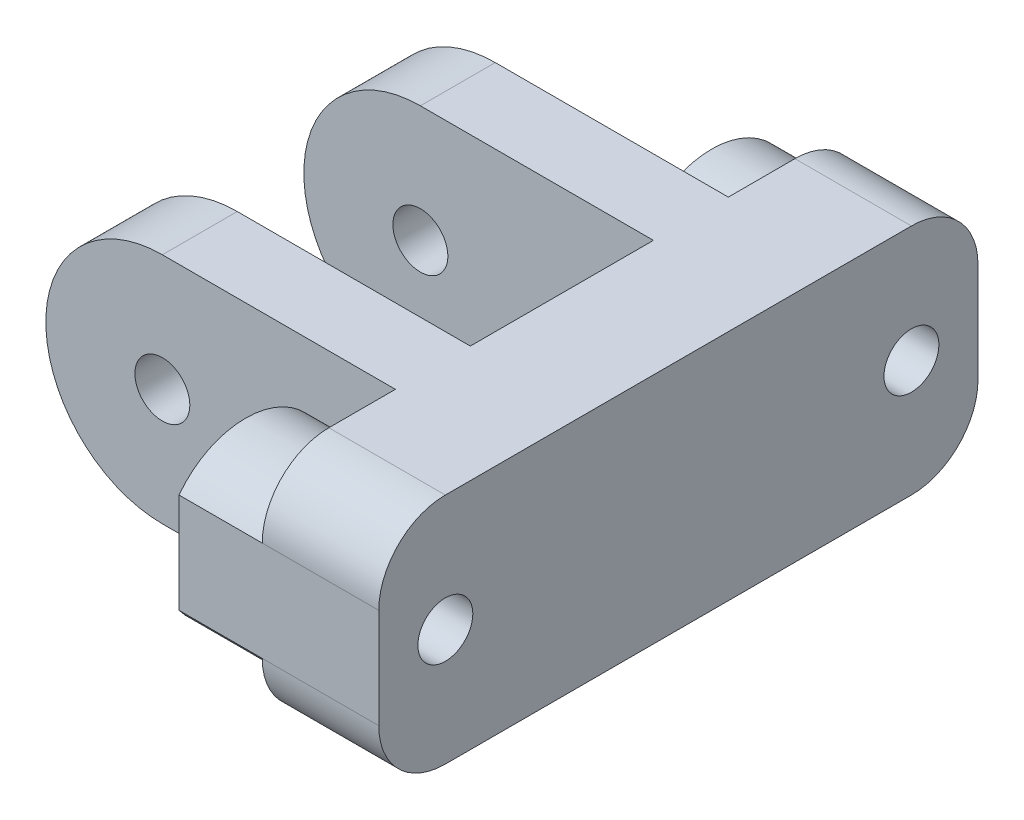
from build123d import *

# Parameters (mm, degrees)
SKETCH1_R               = 1.65
BOSS_EXTRUDE1_DEPTH     = 10
CUT_EXTRUDE1_DEPTH      = 19.574175621
CUT_EXTRUDE1_DEPTH_BACK = 19.574175621
SKETCH2_W               = 21
SKETCH2_H               = 11
SKETCH4_W               = 36
SKETCH4_H               = 14
SKETCH4_R               = 1.65
BOSS_EXTRUDE2_DEPTH     = 7
BOSS_EXTRUDE3_DEPTH     = 5
FILLET1_R               = 4


with BuildPart() as part:
    # Sketch1 → Boss-Extrude1 (new, symmetric)
    with BuildSketch(Plane.XY):
        with BuildLine():
            Line((0, 7), (14, 7))
            Line((14, 7), (14, -7))
            Line((14, -7), (0, -7))
            ThreePointArc((0, -7), (-7, 0), (0, 7))
        make_face()
        Circle(SKETCH1_R, mode=Mode.SUBTRACT)
    extrude(amount=BOSS_EXTRUDE1_DEPTH, both=True)

    # Sketch2 → Cut-Extrude1 (cut, two sides: drawn at the far end of the back side and taken through both)
    with BuildSketch(Plane(origin=(0, 0, 0), x_dir=(1, 0, 0), z_dir=(0, 1, 0)).offset(-CUT_EXTRUDE1_DEPTH_BACK)):
        with Locations((3.5, 0)):
            Rectangle(SKETCH2_W, SKETCH2_H)
    extrude(amount=CUT_EXTRUDE1_DEPTH + CUT_EXTRUDE1_DEPTH_BACK, mode=Mode.SUBTRACT)


with BuildPart() as cut_extrude1_piece_1:
    # of the separate pieces the step leaves, piece 1, a body of its own (cut_extrude1_pieces)
    add(part.part.solids().sort_by_distance((0, 7, -10))[0])



with BuildPart() as cut_extrude1_piece_2:
    # of the separate pieces the step leaves, piece 2, a body of its own (cut_extrude1_pieces)
    add(part.part.solids().sort_by_distance((0, 7, 5.5))[0])


with BuildPart() as cut_extrude1_piece_1_1:
    add(cut_extrude1_piece_1.part)

    add(cut_extrude1_piece_2.part)  # Boss-Extrude2 merges Cut-Extrude1 piece 2
    # Sketch4 → Boss-Extrude2 (add)
    with BuildSketch(Plane(origin=(14, 0, 0), x_dir=(0, 0, -1), z_dir=(1, 0, 0))):
        Rectangle(SKETCH4_W, SKETCH4_H)
        with Locations((14, 0)):
            Circle(SKETCH4_R, mode=Mode.SUBTRACT)
        with Locations((-14, 0)):
            Circle(SKETCH4_R, mode=Mode.SUBTRACT)
    extrude(amount=BOSS_EXTRUDE2_DEPTH)

    # Sketch5 → Boss-Extrude3 (add)
    # profile 1 of 2: a face of its own
    with BuildSketch(Plane.ZY.offset(-14)):
        with BuildLine():
            Line((10, 3), (10, -3))
            ThreePointArc((10, -3), (14, -5), (18, -3))
            Line((18, -3), (18, 3))
            ThreePointArc((18, 3), (14, 5), (10, 3))
        make_face()
        Polygon((12.340117976, -2.875), (15.659882024, -2.875), (17.319764048, 0), (15.659882024, 2.875), (12.340117976, 2.875), (10.680235952, 0), align=None, mode=Mode.SUBTRACT)
    # profile 2 of 2: a face of its own
    with BuildSketch(Plane.ZY.offset(-14)):
        with BuildLine():
            Line((-18, 3), (-18, -3))
            ThreePointArc((-18, -3), (-14, -5), (-10, -3))
            Line((-10, -3), (-10, 3))
            ThreePointArc((-10, 3), (-14, 5), (-18, 3))
        make_face()
        Polygon((-10.680235952, 0), (-12.340117976, -2.875), (-15.659882024, -2.875), (-17.319764048, 0), (-15.659882024, 2.875), (-12.340117976, 2.875), align=None, mode=Mode.SUBTRACT)
    extrude(amount=BOSS_EXTRUDE3_DEPTH)

    # Fillet1
    fillet1_edges = [cut_extrude1_piece_1_1.edges().sort_by_distance(p)[0] for p in [
        (17.5, 7, 18),
        (17.5, -7, 18),
        (17.5, 7, -18),
        (17.5, -7, -18),
    ]]
    fillet(fillet1_edges, radius=FILLET1_R)


solid = cut_extrude1_piece_1_1.part
